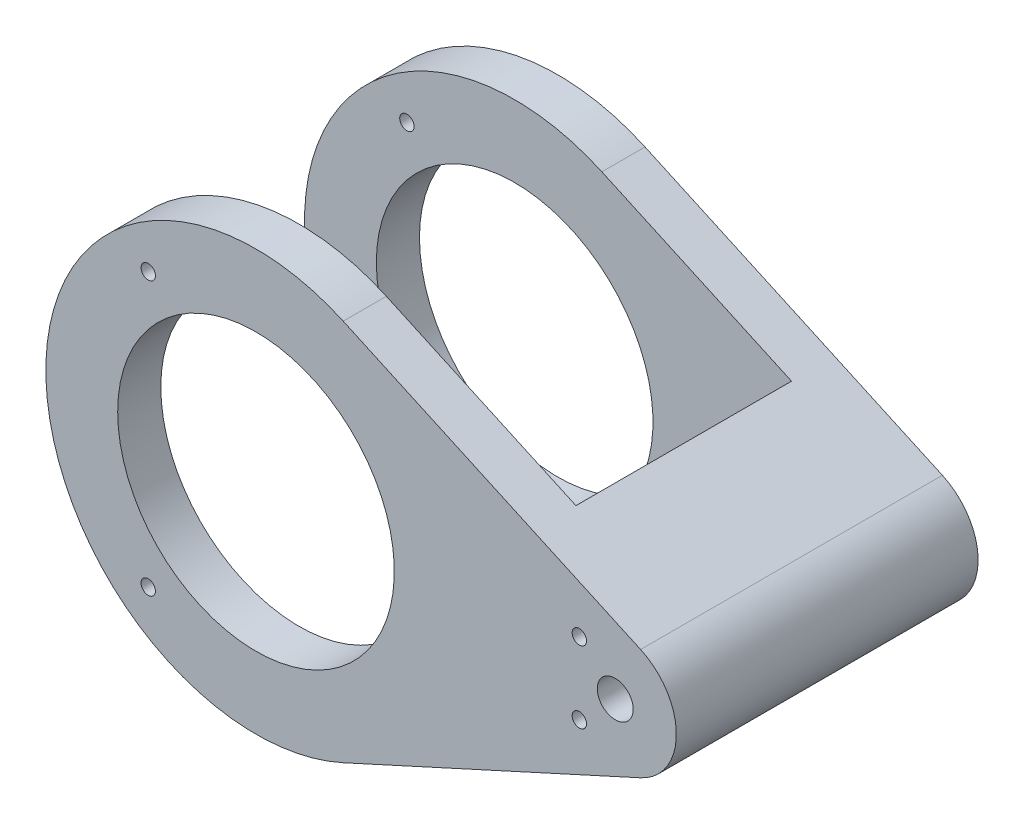
from build123d import *

# Parameters (mm, degrees)
ESQUISSE1_R                  = 19.25
ESQUISSE1_R_2                = 2.5
BOSS_EXTRU_1_DEPTH           = 42
ENL_V_MAT_EXTRU_1_DEPTH      = 74.881298321
ENL_V_MAT_EXTRU_1_DEPTH_BACK = 74.881298321
ESQUISSE2_W                  = 90
ESQUISSE2_H                  = 30
ESQUISSE3_R                  = 1
ENL_V_MAT_EXTRU_2_DEPTH      = 42


with BuildPart() as part:
    # Esquisse1 → Boss.-Extru.1 (new body)
    with BuildSketch(Plane.XY):
        with BuildLine():
            Line((12.13875, 26.612276273), (53.5275, 7.733481994))
            ThreePointArc((53.5275, 7.733481994), (58.5, 0), (53.5275, -7.733481994))
            Line((53.5275, -7.733481994), (12.13875, -26.612276273))
            ThreePointArc((12.13875, -26.612276273), (-29.25, 0), (12.13875, 26.612276273))
        make_face()
        with Locations(Location((0, 0, 0), (0, 0, 180))):
            Circle(ESQUISSE1_R, mode=Mode.SUBTRACT)
        with Locations(Location((50, 0, 0), (0, 0, 180))):
            Circle(ESQUISSE1_R_2, mode=Mode.SUBTRACT)
    extrude(amount=BOSS_EXTRU_1_DEPTH)

    # Esquisse2 → Enlèv. mat.-Extru.1 (cut, two sides: drawn at the far end of the back side and taken through both)
    with BuildSketch(Plane(origin=(5.218823759, 0, 0), x_dir=(1, 0, 0), z_dir=(0, 1, 0)).offset(-ENL_V_MAT_EXTRU_1_DEPTH_BACK)):
        with Locations((-11.691323759, -21)):
            Rectangle(ESQUISSE2_W, ESQUISSE2_H)
    extrude(amount=ENL_V_MAT_EXTRU_1_DEPTH + ENL_V_MAT_EXTRU_1_DEPTH_BACK, mode=Mode.SUBTRACT)

    # Esquisse3 → Enlèv. mat.-Extru.2 (cut)
    with BuildSketch(Plane.XY.offset(42)):
        with Locations((45, 5)):
            Circle(ESQUISSE3_R)
        with Locations((45, -5)):
            Circle(ESQUISSE3_R)
        with Locations((-15, 19)):
            Circle(ESQUISSE3_R)
        with Locations((-15, -19)):
            Circle(ESQUISSE3_R)
    extrude(amount=-ENL_V_MAT_EXTRU_2_DEPTH, mode=Mode.SUBTRACT)


solid = part.part
